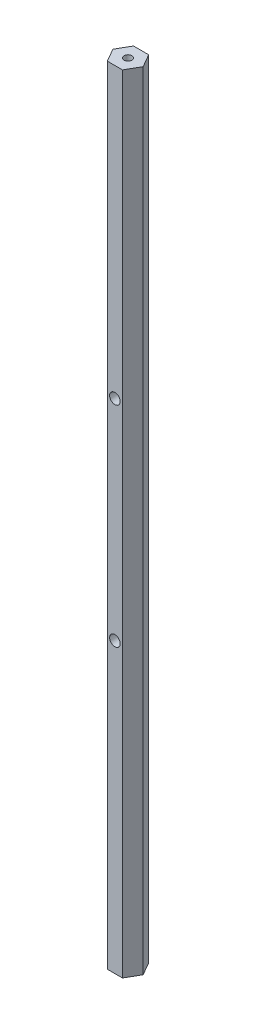
from build123d import *

# Parameters (mm, degrees)
BOSS_EXTRUDE1_DEPTH    = 381
F_10_CLEARANCE_HOLE1_D = 5.1054


with BuildPart() as part:
    # Sketch1 → Boss-Extrude1 (new body)
    with BuildSketch(Plane(origin=(0, 0, 0), x_dir=(1, 0, 0), z_dir=(0, 1, 0))):
        Polygon((7.332348419, 0), (3.666174209, 6.35), (-3.666174209, 6.35), (-7.332348419, 0), (-3.666174209, -6.35), (3.666174209, -6.35), align=None)
    extrude(amount=BOSS_EXTRUDE1_DEPTH)

    # Sketch2 → Tap Drill for #10-24 Tap1 (revolve, cut)
    with BuildSketch(Plane(origin=(0, 381, 0), x_dir=(0, 0, 1), z_dir=(1, 0, 0))):
        Polygon((0, 0), (0, 26.540824014), (1.89865, 25.4), (1.89865, 0), align=None)
    tap_drill_for_10_24_tap1 = revolve(axis=Axis((0, 387.35, 0), (0, -1, 0)), mode=Mode.SUBTRACT)

    # Mirror1: Tap Drill for #10-24 Tap1 across plane
    add(tap_drill_for_10_24_tap1.mirror(Plane.ZX.offset(190.5)), mode=Mode.SUBTRACT)

    # #10 Clearance Hole1 (through all)
    with Locations(Plane(origin=(0, 0, -6.35), x_dir=(-1, 0, 0), z_dir=(0, 0, -1))):
        with Locations((0, 139.7), (0, 241.3)):
            Hole(F_10_CLEARANCE_HOLE1_D / 2)


solid = part.part
